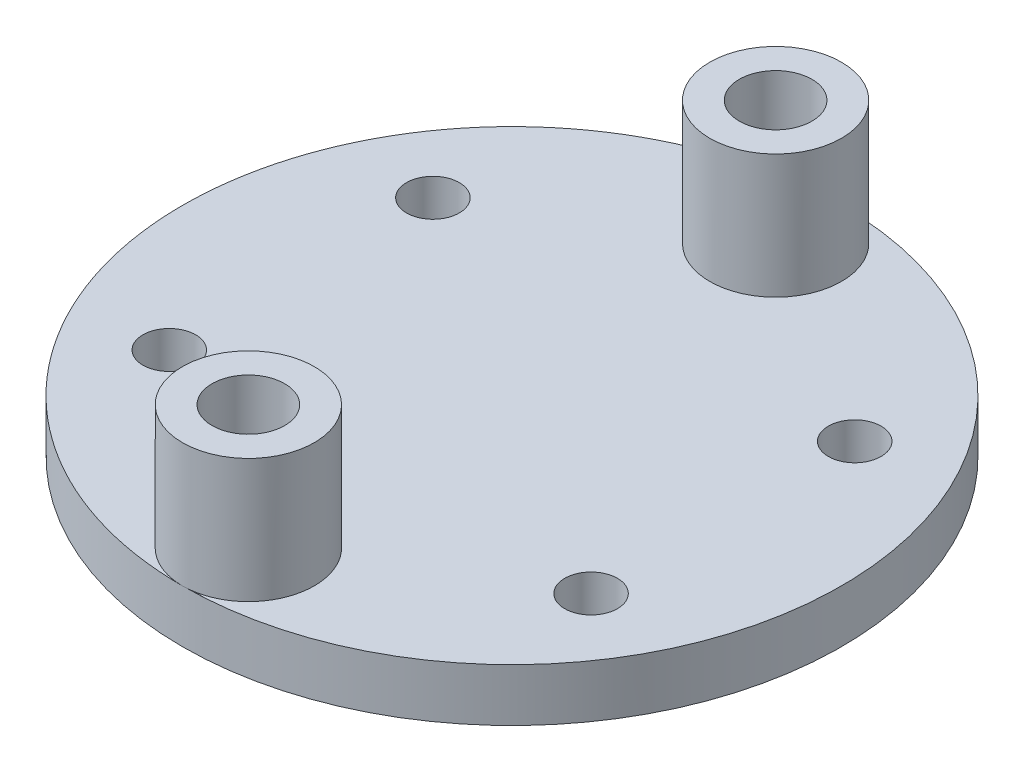
from build123d import *

# Parameters (mm, degrees)
SKETCH1_R           = 15.875
SKETCH1_R_2         = 1.75
SKETCH1_W           = 25.4
SKETCH1_H           = 17.78
SKETCH1_R_3         = 1.27
BOSS_EXTRUDE1_DEPTH = 2.54
SKETCH2_R           = 3.175
SKETCH2_R_2         = 1.75
BOSS_EXTRUDE2_DEPTH = 5.974999988


with BuildPart() as part:
    # Sketch1 → Boss-Extrude1 (new body)
    # profile 1 of 2: a face of its own
    with BuildSketch(Plane(origin=(0, 0, 0), x_dir=(1, 0, 0), z_dir=(0, 1, 0))):
        with Locations(Location((12.7, 8.89, 0), (0, 0, 270))):
            Circle(SKETCH1_R)
        with Locations(Location((12.7, 21.59, 0), (0, 0, 270))):
            Circle(SKETCH1_R_2, mode=Mode.SUBTRACT)
        with Locations(Location((12.7, -3.81, 0), (0, 0, 270))):
            Circle(SKETCH1_R_2, mode=Mode.SUBTRACT)
        with Locations((12.7, 8.89)):
            Rectangle(SKETCH1_W, SKETCH1_H, mode=Mode.SUBTRACT)
    # profile 2 of 2: a face of its own
    with BuildSketch(Plane(origin=(0, 0, 0), x_dir=(1, 0, 0), z_dir=(0, 1, 0))):
        with Locations((12.7, 8.89)):
            Rectangle(SKETCH1_W, SKETCH1_H)
        with Locations(Location((22.86, 15.24, 0), (0, 0, 270))):
            Circle(SKETCH1_R_3, mode=Mode.SUBTRACT)
        with Locations(Location((2.54, 15.24, 0), (0, 0, 270))):
            Circle(SKETCH1_R_3, mode=Mode.SUBTRACT)
        with Locations(Location((22.86, 2.54, 0), (0, 0, 270))):
            Circle(SKETCH1_R_3, mode=Mode.SUBTRACT)
        with Locations(Location((2.54, 2.54, 0), (0, 0, 270))):
            Circle(SKETCH1_R_3, mode=Mode.SUBTRACT)
    extrude(amount=BOSS_EXTRUDE1_DEPTH)

    # Sketch2 → Boss-Extrude2 (add)
    # profile 1 of 2: a face of its own
    with BuildSketch(Plane(origin=(0, 2.54, 0), x_dir=(1, 0, 0), z_dir=(0, 1, 0))):
        with Locations(Location((12.7, 21.59, 0), (0, 0, 89.999491582))):
            Circle(SKETCH2_R)
        with Locations(Location((12.7, 21.59, 0), (0, 0, 270))):
            Circle(SKETCH2_R_2, mode=Mode.SUBTRACT)
    # profile 2 of 2: a face of its own
    with BuildSketch(Plane(origin=(0, 2.54, 0), x_dir=(1, 0, 0), z_dir=(0, 1, 0))):
        with Locations(Location((12.7, -3.81, 0), (0, 0, 269.999491581))):
            Circle(SKETCH2_R)
        with Locations(Location((12.7, -3.81, 0), (0, 0, 270))):
            Circle(SKETCH2_R_2, mode=Mode.SUBTRACT)
    extrude(amount=BOSS_EXTRUDE2_DEPTH)


solid = part.part
